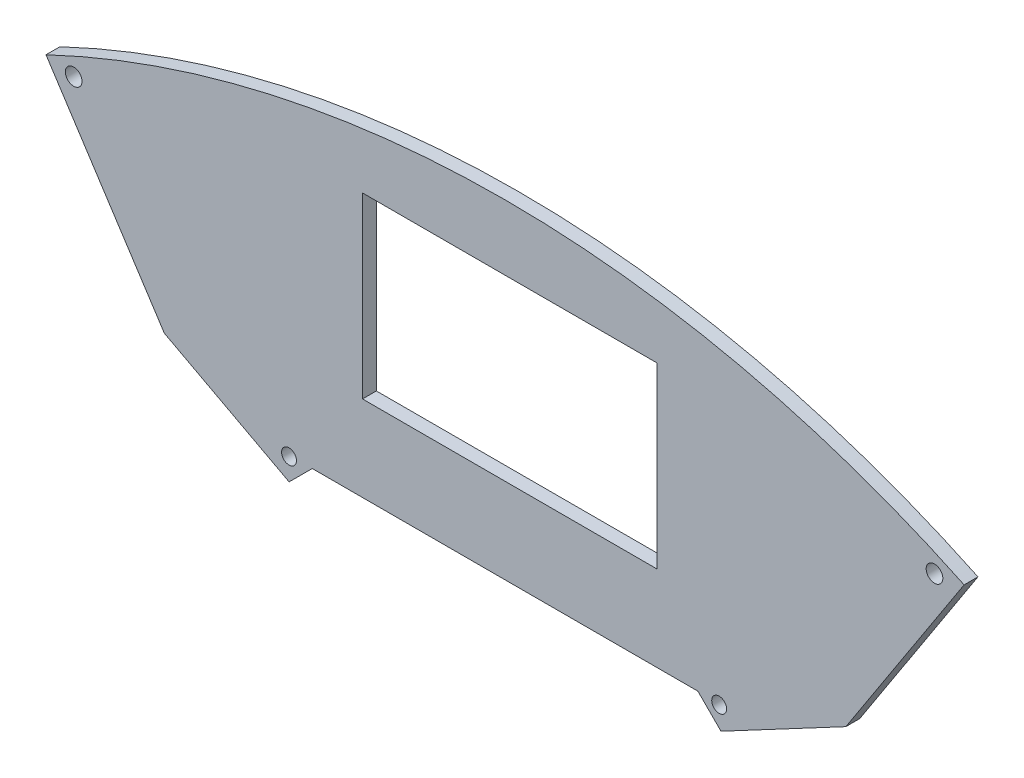
from build123d import *

# Parameters (mm, degrees)
BOSS_EXTRUDE1_DEPTH = 4
SKETCH2_W           = 85
SKETCH2_H           = 51.5
CUT_EXTRUDE1_DEPTH  = 20
CUT_EXTRUDE3_START  = 10
SKETCH3_R           = 2.404549827
SKETCH3_R_2         = 2.15
CUT_EXTRUDE3_DEPTH  = 20


with BuildPart() as part:
    # Sketch1 → Boss-Extrude1 (new body)
    with BuildSketch(Plane.XY):
        with BuildLine():
            Line((-54.022988506, -46.729885057), (-60.700936328, -53.40783288))
            Line((-60.700936328, -53.40783288), (-96.723977713, -34.253129761))
            Line((-96.723977713, -34.253129761), (-130.872988506, 18.270114943))
            ThreePointArc((-130.872988506, 18.270114943), (1.627011494, 48.270114943), (134.127011494, 18.270114943))
            Line((134.127011494, 18.270114943), (99.978000701, -34.253129761))
            Line((99.978000701, -34.253129761), (63.954959317, -53.40783288))
            Line((63.954959317, -53.40783288), (57.277011494, -46.729885057))
            Line((57.277011494, -46.729885057), (-54.022988506, -46.729885057))
        make_face()
    extrude(amount=BOSS_EXTRUDE1_DEPTH)

    # Sketch2 → Cut-Extrude1 (cut)
    with BuildSketch(Plane.XY):
        with Locations((2.977011494, 3.662316168)):
            Rectangle(SKETCH2_W, SKETCH2_H)
    extrude(amount=CUT_EXTRUDE1_DEPTH, mode=Mode.SUBTRACT)

    # Sketch3 → Cut-Extrude3 (cut)
    with BuildSketch(Plane.XY.offset(CUT_EXTRUDE3_START)):
        with Locations(Location((-122.881880972, 16.804537187, 0), (0, 0, 180))):
            Circle(SKETCH3_R)
        with Locations(Location((-60.728139954, -47.058565961, 0), (0, 0, 180))):
            Circle(SKETCH3_R_2)
        with Locations(Location((63.420208839, -47.058565961, 0), (0, 0, 180))):
            Circle(SKETCH3_R_2)
        with Locations(Location((125.573949857, 16.804537187, 0), (0, 0, 180))):
            Circle(SKETCH3_R)
    extrude(amount=-CUT_EXTRUDE3_DEPTH, mode=Mode.SUBTRACT)


solid = part.part
